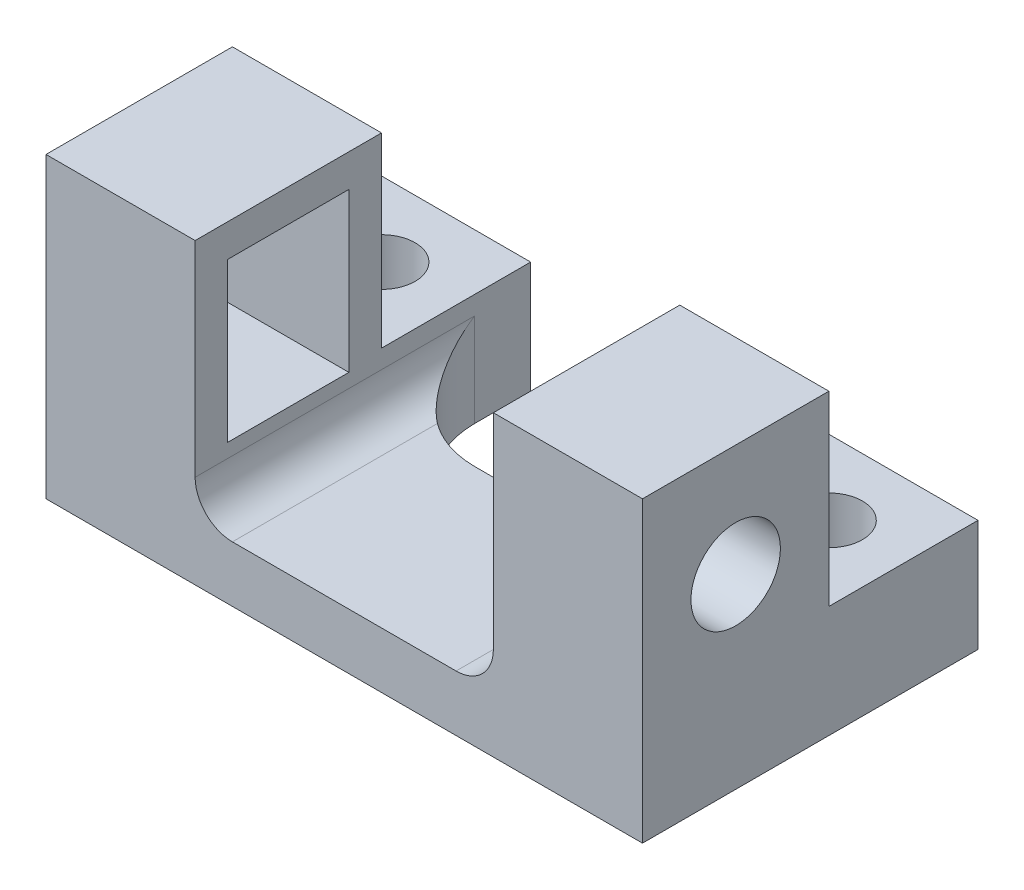
from build123d import *

# Parameters (mm, degrees)
SKETCH1_W                  = 16
SKETCH1_H                  = 5
BOSS_EXTRUDE1_DEPTH        = 4
SKETCH2_W                  = 8
SKETCH2_H                  = 5
CUT_EXTRUDE1_DEPTH         = 6.5
SKETCH3_W                  = 3.25
SKETCH3_H                  = 4.25
CUT_EXTRUDE2_DEPTH         = 4
M2_CLEARANCE_HOLE2_D       = 2.4
M2_CLEARANCE_HOLE2_DEPTH   = 4
M2_CLEARANCE_HOLE2_TIP     = 0.721032743
SKETCH10_W                 = 4
SKETCH10_H                 = 4
BOSS_EXTRUDE2_DEPTH        = 3
M1_6_CLEARANCE_HOLE1_D     = 1.8
M1_6_CLEARANCE_HOLE1_DEPTH = 4
M1_6_CLEARANCE_HOLE1_TIP   = 0.540774557
FILLET1_R                  = 1
FILLET2_R                  = 2.5


with BuildPart() as part:
    # Sketch1 → Boss-Extrude1 (new, symmetric)
    with BuildSketch(Plane(origin=(0, 0, 0), x_dir=(1, 0, 0), z_dir=(0, 1, 0))):
        Rectangle(SKETCH1_W, SKETCH1_H)
    extrude(amount=BOSS_EXTRUDE1_DEPTH, both=True)

    # Sketch2 → Cut-Extrude1 (cut)
    with BuildSketch(Plane(origin=(0, 4, 5), x_dir=(1, 0, 0), z_dir=(0, -1, 0))):
        with Locations((0, -5)):
            Rectangle(SKETCH2_W, SKETCH2_H)
    extrude(amount=CUT_EXTRUDE1_DEPTH, mode=Mode.SUBTRACT)

    # Sketch3 → Cut-Extrude2 (cut)
    with BuildSketch(Plane.ZY.offset(8)):
        with Locations((0, 1)):
            Rectangle(SKETCH3_W, SKETCH3_H)
    extrude(amount=-CUT_EXTRUDE2_DEPTH, mode=Mode.SUBTRACT)

    # M2 Clearance Hole2
    with Locations(Plane(origin=(8, 0, 0), x_dir=(0, 0, -1), z_dir=(1, 0, 0))):
        with Locations((0, 1)):
            Hole(M2_CLEARANCE_HOLE2_D / 2, depth=M2_CLEARANCE_HOLE2_DEPTH)
            with Locations((0, 0, -(M2_CLEARANCE_HOLE2_DEPTH + M2_CLEARANCE_HOLE2_TIP / 2))):  # 118° drill point
                Cone(0, M2_CLEARANCE_HOLE2_D / 2, M2_CLEARANCE_HOLE2_TIP, mode=Mode.SUBTRACT)

    # Sketch10 → Boss-Extrude2 (add)
    with BuildSketch(Plane.XZ.offset(4)):
        with Locations((6, -4.5)):
            Rectangle(SKETCH10_W, SKETCH10_H)
        with Locations((-6, -4.5)):
            Rectangle(SKETCH10_W, SKETCH10_H)
    extrude(amount=-BOSS_EXTRUDE2_DEPTH)

    # M1.6 Clearance Hole1
    with Locations(Plane(origin=(0, -1, 0), x_dir=(1, 0, 0), z_dir=(0, 1, 0))):
        with Locations((6, 4.5), (-6, 4.5)):
            Hole(M1_6_CLEARANCE_HOLE1_D / 2, depth=M1_6_CLEARANCE_HOLE1_DEPTH)
            with Locations((0, 0, -(M1_6_CLEARANCE_HOLE1_DEPTH + M1_6_CLEARANCE_HOLE1_TIP / 2))):  # 118° drill point
                Cone(0, M1_6_CLEARANCE_HOLE1_D / 2, M1_6_CLEARANCE_HOLE1_TIP, mode=Mode.SUBTRACT)

    # Fillet1
    fillet1_edges = [part.edges().sort_by_distance(p)[0] for p in [
        (4, -2.5, 0),
        (-4, -2.5, 0),
    ]]
    fillet(fillet1_edges, radius=FILLET1_R)

    # Fillet2
    fillet2_edges = [part.edges().sort_by_distance(p)[0] for p in [
        (-4, -2.75, -2.5),
        (4, -2.75, -2.5),
    ]]
    fillet(fillet2_edges, radius=FILLET2_R)


solid = part.part
